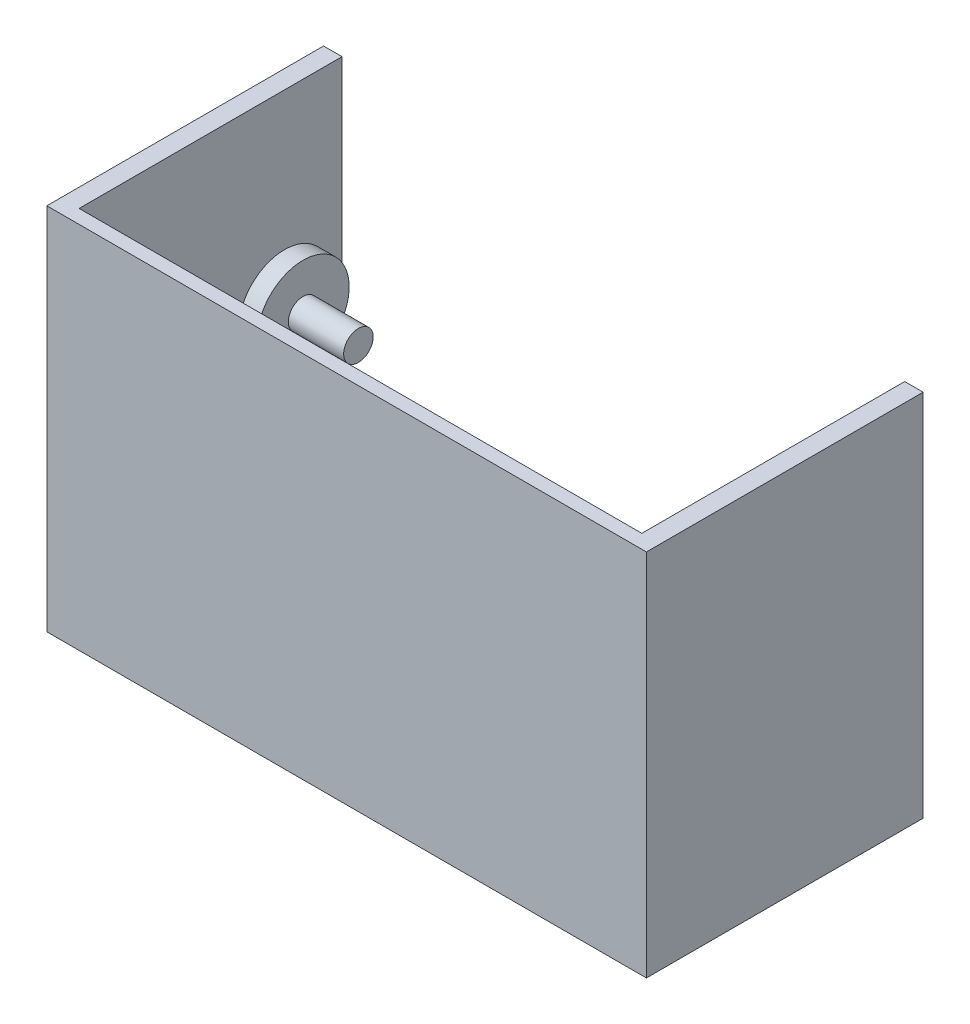
from build123d import *

# Parameters (mm, degrees)
ESBO_O1_W                = 65
ESBO_O1_H                = 40
RESSALTO_EXTRUS_O1_DEPTH = 30
ESBO_O2_W                = 61
ESBO_O2_H                = 37
CORTE_EXTRUS_O1_DEPTH    = 20
ESBO_O3_W                = 61
ESBO_O3_H                = 27
CORTE_EXTRUS_O2_DEPTH    = 49
ESBO_O5_W                = 61
ESBO_O5_H                = 1.5
CORTE_EXTRUS_O3_DEPTH    = 49
ESBO_O7_R                = 5
RESSALTO_EXTRUS_O2_DEPTH = 4
ESBO_O8_R                = 1.6
RESSALTO_EXTRUS_O3_DEPTH = 6
ESBO_O10_R               = 3.5
RESSALTO_EXTRUS_O4_DEPTH = 6
ESBO_O12_R               = 2.75
CORTE_EXTRUS_O4_DEPTH    = 4


with BuildPart() as part:
    # Esboço1 → Ressalto-extrusão1 (new body)
    with BuildSketch(Plane.XY):
        Rectangle(ESBO_O1_W, ESBO_O1_H)
    extrude(amount=RESSALTO_EXTRUS_O1_DEPTH)

    # Esboço2 → Corte-extrusão1 (cut)
    with BuildSketch(Plane(origin=(0, 0, 0), x_dir=(-1, 0, 0), z_dir=(0, 0, -1))):
        Rectangle(ESBO_O2_W, ESBO_O2_H)
    extrude(amount=-CORTE_EXTRUS_O1_DEPTH, mode=Mode.SUBTRACT)

    # Esboço3 → Corte-extrusão2 (cut)
    with BuildSketch(Plane(origin=(0, 20, 0), x_dir=(1, 0, 0), z_dir=(0, 1, 0))):
        with Locations((0, -15)):
            Rectangle(ESBO_O3_W, ESBO_O3_H)
    extrude(amount=-CORTE_EXTRUS_O2_DEPTH, mode=Mode.SUBTRACT)

    # Esboço5 → Corte-extrusão3 (cut)
    with BuildSketch(Plane(origin=(0, 20, 0), x_dir=(1, 0, 0), z_dir=(0, 1, 0))):
        with Locations((0, -0.75)):
            Rectangle(ESBO_O5_W, ESBO_O5_H)
    extrude(amount=-CORTE_EXTRUS_O3_DEPTH, mode=Mode.SUBTRACT)

    # Esboço7 → Ressalto-extrusão2 (add)
    with BuildSketch(Plane.ZY.offset(32.5)):
        with Locations((6.224890869, 0)):
            Circle(ESBO_O7_R)
    extrude(amount=-RESSALTO_EXTRUS_O2_DEPTH)

    # Esboço8 → Ressalto-extrusão3 (add)
    with BuildSketch(Plane(origin=(-28.5, 0, 0), x_dir=(0, 0, -1), z_dir=(1, 0, 0))):
        with Locations((-6.224890869, 0)):
            Circle(ESBO_O8_R)
    extrude(amount=RESSALTO_EXTRUS_O3_DEPTH)

    # Esboço10 → Ressalto-extrusão4 (add)
    with BuildSketch(Plane(origin=(32.5, 0, 0), x_dir=(0, 0, -1), z_dir=(1, 0, 0))):
        with Locations(Location((-6.224890869, 0, 0), (0, 0, 90))):
            Circle(ESBO_O10_R)
    extrude(amount=-RESSALTO_EXTRUS_O4_DEPTH)

    # Esboço12 → Corte-extrusão4 (cut)
    with BuildSketch(Plane.ZY.offset(-26.5)):
        with Locations(Location((6.224890869, 0, 0), (0, 0, 270))):
            Circle(ESBO_O12_R)
    extrude(amount=-CORTE_EXTRUS_O4_DEPTH, mode=Mode.SUBTRACT)


solid = part.part
